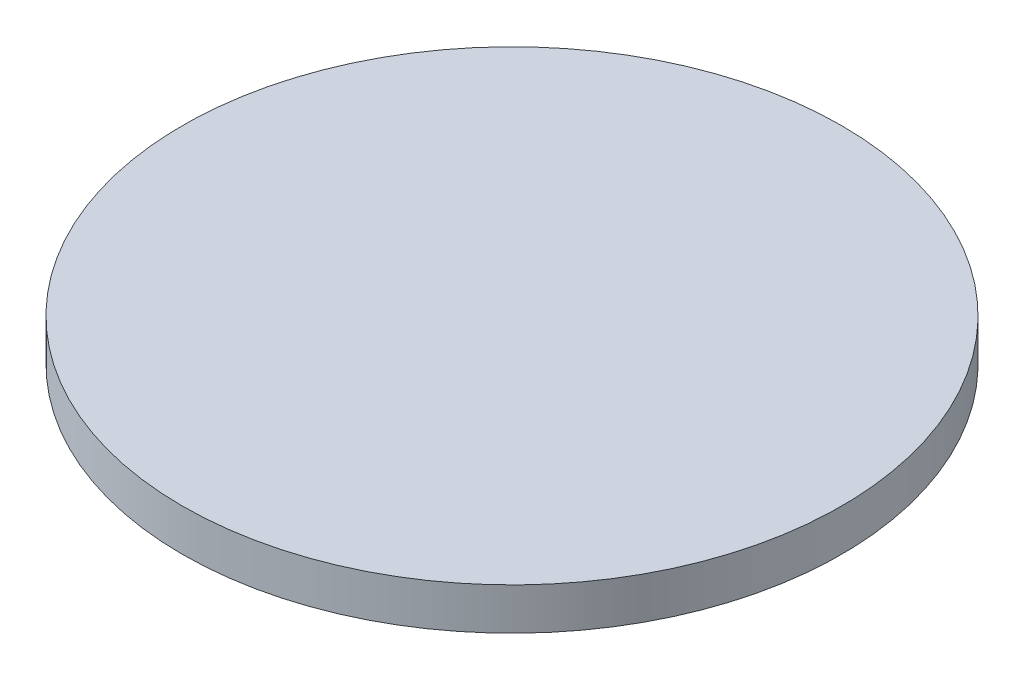
from build123d import *

# Parameters (mm, degrees)
SKETCH1_R           = 50
BOSS_EXTRUDE1_DEPTH = 6.35


with BuildPart() as part:
    # Sketch1 → Boss-Extrude1 (new body)
    with BuildSketch(Plane(origin=(0, 0, 0), x_dir=(1, 0, 0), z_dir=(0, 1, 0))):
        with Locations(Location((0, 0, 0), (0, 0, 270))):
            Circle(SKETCH1_R)
    extrude(amount=BOSS_EXTRUDE1_DEPTH)


solid = part.part
